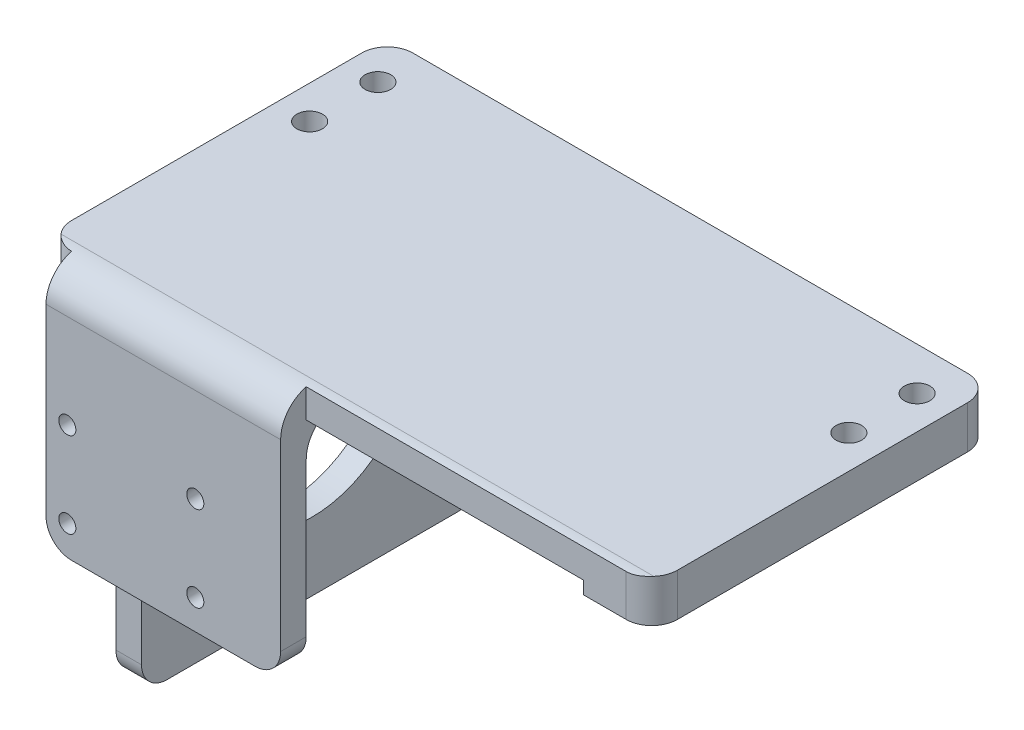
from build123d import *

# Parameters (mm, degrees)
SKETCH_1_W          = 14
SKETCH_1_H          = 40
SKETCH_1_R          = 1.5
EXTRUDE_1_DEPTH     = 5
EXTRUDE_1_2_DEPTH   = 5
SKETCH_3_W          = 3
SKETCH_3_H          = 40
EXTRUDE_3_DEPTH     = 36
SKETCH_4_R          = 1.5
SKETCH_4_R_2        = 12
CUT_EXTRUDE_1_DEPTH = 30
SKETCH_8_W          = 43
SKETCH_8_H          = 5
EXTRUDE_4_DEPTH     = 40
SKETCH_9_W          = 51.8
SKETCH_9_H          = 40
CUT_EXTRUDE_2_DEPTH = 1.5
FILLET_1_R          = 3
SKETCH_10_W         = 19.3
SKETCH_10_H         = 25
SKETCH_10_R         = 1
SKETCH_10_W_2       = 5.2
SKETCH_10_H_2       = 23.5
EXTRUDE_5_DEPTH     = 3
SKETCH_11_R         = 2.5
SKETCH_11_R_2       = 2
CUT_EXTRUDE_3_DEPTH = 1
FILLET_2_R          = 4
FILLET_3_R          = 3


with BuildPart() as part:
    # 草图1 → 凸台-拉伸1 (new body)
    with BuildSketch(Plane(origin=(0, 0, 0), x_dir=(1, 0, 0), z_dir=(0, 1, 0))):
        with Locations((-28.5, 0)):
            Rectangle(SKETCH_1_W, SKETCH_1_H)
        with Locations(Location((-31.6, 7, 0), (0, 0, 270))):
            Circle(SKETCH_1_R, mode=Mode.SUBTRACT)
        with Locations(Location((-31.6, 15, 0), (0, 0, 270))):
            Circle(SKETCH_1_R, mode=Mode.SUBTRACT)
    extrude(amount=EXTRUDE_1_DEPTH)

    # 草图3 → 凸台-拉伸3 (add)
    with BuildSketch(Plane.XZ):
        with Locations((-25.8, 0)):
            Rectangle(SKETCH_3_W, SKETCH_3_H)
    extrude(amount=EXTRUDE_3_DEPTH)

    # 草图4 → 切除-拉伸1 (cut)
    with BuildSketch(Plane.ZY.offset(27.3)):
        with Locations((13, -3)):
            Circle(SKETCH_4_R)
        with Locations((13, -29)):
            Circle(SKETCH_4_R)
        with Locations((-13, -29)):
            Circle(SKETCH_4_R)
        with Locations((0, -16)):
            Circle(SKETCH_4_R_2)
    extrude(amount=-CUT_EXTRUDE_1_DEPTH, mode=Mode.SUBTRACT)



with BuildPart() as body_2:
    # 草图1 → Extrude 1 2 (new body)
    with BuildSketch(Plane(origin=(0, 0, 0), x_dir=(1, 0, 0), z_dir=(0, 1, 0))):
        with Locations((28.5, 0)):
            Rectangle(SKETCH_1_W, SKETCH_1_H)
        with Locations(Location((31.6, 7, 0), (0, 0, 270))):
            Circle(SKETCH_1_R, mode=Mode.SUBTRACT)
        with Locations(Location((31.6, 15, 0), (0, 0, 270))):
            Circle(SKETCH_1_R, mode=Mode.SUBTRACT)
    extrude(amount=EXTRUDE_1_2_DEPTH)


with BuildPart() as part_1:
    add(part.part)

    add(body_2.part)  # 凸台-拉伸4 merges body 2
    # 草图8 → 凸台-拉伸4 (add)
    with BuildSketch(Plane.XY.offset(20)):
        with Locations((0, 2.5)):
            Rectangle(SKETCH_8_W, SKETCH_8_H)
    extrude(amount=-EXTRUDE_4_DEPTH)

    # 草图9 → 切除-拉伸2 (cut)
    with BuildSketch(Plane.XZ):
        with Locations((1.6, 0)):
            Rectangle(SKETCH_9_W, SKETCH_9_H)
    extrude(amount=-CUT_EXTRUDE_2_DEPTH, mode=Mode.SUBTRACT)

    # 圆角1
    fillet_1_edges = [part_1.edges().sort_by_distance(p)[0] for p in [
        (-35.5, 2.5, 20),
        (-35.5, 2.5, -20),
        (-25.8, -36, -20),
        (-25.8, -36, 20),
        (35.5, 2.5, 20),
        (35.5, 2.5, -20),
    ]]
    fillet(fillet_1_edges, radius=FILLET_1_R)

    # 草图10 → 凸台-拉伸5 (add)
    # profile 1 of 4: a face of its own
    with BuildSketch(Plane.XY.offset(20)):
        Polygon((-32.5, 5), (-32.5, 1.5), (-24.3, 1.5), (-5, 1.5), (-5, 5), align=None)
    # profile 2 of 4: a face of its own
    with BuildSketch(Plane.XY.offset(20)):
        with Locations((-14.65, -11)):
            Rectangle(SKETCH_10_W, SKETCH_10_H)
        with Locations((-15, -20)):
            Circle(SKETCH_10_R, mode=Mode.SUBTRACT)
        with Locations((-15, -10)):
            Circle(SKETCH_10_R, mode=Mode.SUBTRACT)
    # profile 3 of 4: a face of its own
    with BuildSketch(Plane.XY.offset(20)):
        Polygon((-32.5, 1.5), (-32.5, 0), (-27.3, 0), (-27.3, -23.5), (-24.3, -23.5), (-24.3, 1.5), align=None)
    # profile 4 of 4: a face of its own
    with BuildSketch(Plane.XY.offset(20)):
        with Locations((-29.9, -11.75)):
            Rectangle(SKETCH_10_W_2, SKETCH_10_H_2)
        with Locations((-30, -20)):
            Circle(SKETCH_10_R, mode=Mode.SUBTRACT)
        with Locations((-30, -10)):
            Circle(SKETCH_10_R, mode=Mode.SUBTRACT)
    extrude(amount=EXTRUDE_5_DEPTH)

    # 草图11 → 切除-拉伸3 (cut)
    with BuildSketch(Plane(origin=(0, 0, 20), x_dir=(-1, 0, 0), z_dir=(0, 0, -1))):
        with Locations((15, -10)):
            Circle(SKETCH_11_R)
        with Locations((30, -10)):
            Circle(SKETCH_11_R_2)
        with Locations((30, -20)):
            Circle(SKETCH_11_R_2)
        with Locations((15, -20)):
            Circle(SKETCH_11_R)
    extrude(amount=-CUT_EXTRUDE_3_DEPTH, mode=Mode.SUBTRACT)

    # 圆角2
    fillet_2_edges = [part_1.edges().sort_by_distance(p)[0] for p in [
        (-14.65, 1.5, 20),
        (-18.75, 5, 23),
    ]]
    fillet(fillet_2_edges, radius=FILLET_2_R)

    # 圆角3
    fillet_3_edges = [part_1.edges().sort_by_distance(p)[0] for p in [
        (-5, -23.5, 21.5),
        (-32.5, -23.5, 21.5),
    ]]
    fillet(fillet_3_edges, radius=FILLET_3_R)


solid = part_1.part
